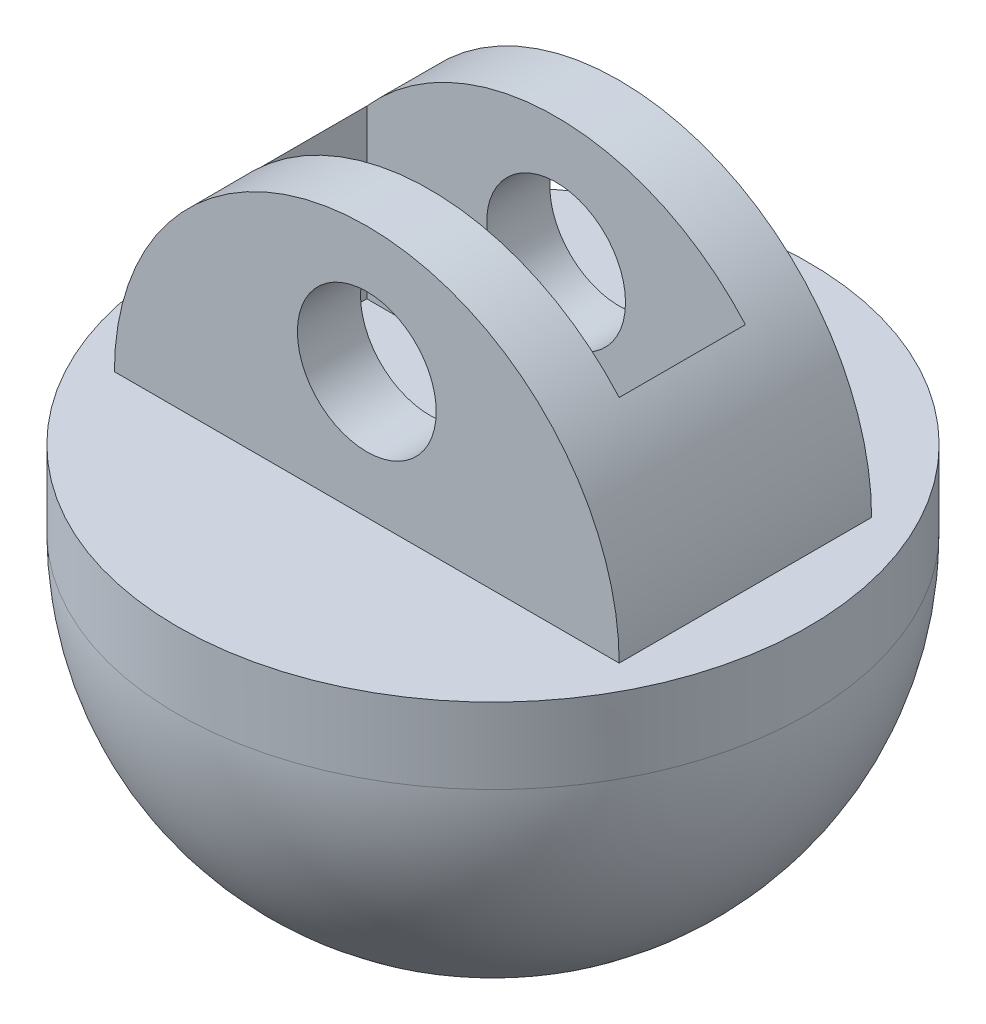
from build123d import *

# Parameters (mm, degrees)
SKETCH8_R            = 25
BOSS_EXTRUDE7_DEPTH  = 6
SKETCH11_R           = 5.5
BOSS_EXTRUDE12_DEPTH = 10
SKETCH14_W           = 30
SKETCH14_H           = 10
CUT_EXTRUDE2_DEPTH   = 41.620192023


with BuildPart() as part:
    # Sketch8 → Boss-Extrude7 (new body)
    with BuildSketch(Plane(origin=(0, 0, 0), x_dir=(1, 0, 0), z_dir=(0, 1, 0))):
        with Locations(Location((0, 0, 0), (0, 0, 270))):
            Circle(SKETCH8_R)
    extrude(amount=BOSS_EXTRUDE7_DEPTH)

    # Sketch11 → Boss-Extrude12 (add, symmetric)
    with BuildSketch(Plane.XY):
        with BuildLine():
            Line((20, 6), (-20, 6))
            ThreePointArc((-20, 6), (0, 26), (20, 6))
        make_face()
        with Locations((0, 16)):
            Circle(SKETCH11_R, mode=Mode.SUBTRACT)
    extrude(amount=BOSS_EXTRUDE12_DEPTH, both=True)

    # Sketch14 → Cut-Extrude2 (cut, through all)
    with BuildSketch(Plane(origin=(0, 6, 0), x_dir=(1, 0, 0), z_dir=(0, 1, 0))):
        Rectangle(SKETCH14_W, SKETCH14_H)
    extrude(amount=CUT_EXTRUDE2_DEPTH, mode=Mode.SUBTRACT)

    # Sketch15 → Revolve1 (revolve)
    with BuildSketch(Plane.XY, mode=Mode.PRIVATE) as revolve1_sk:
        with BuildLine():
            Line((0, 0), (0, -25))
            ThreePointArc((0, -25), (17.67766953, -17.67766953), (25, 0))
            Line((25, 0), (0, 0))
        make_face()
    revolve(revolve1_sk.sketch.rotate(Axis((0, 0, 0), (0, -1, 0)), 180), axis=Axis((0, 0, 0), (0, -1, 0)))


solid = part.part
